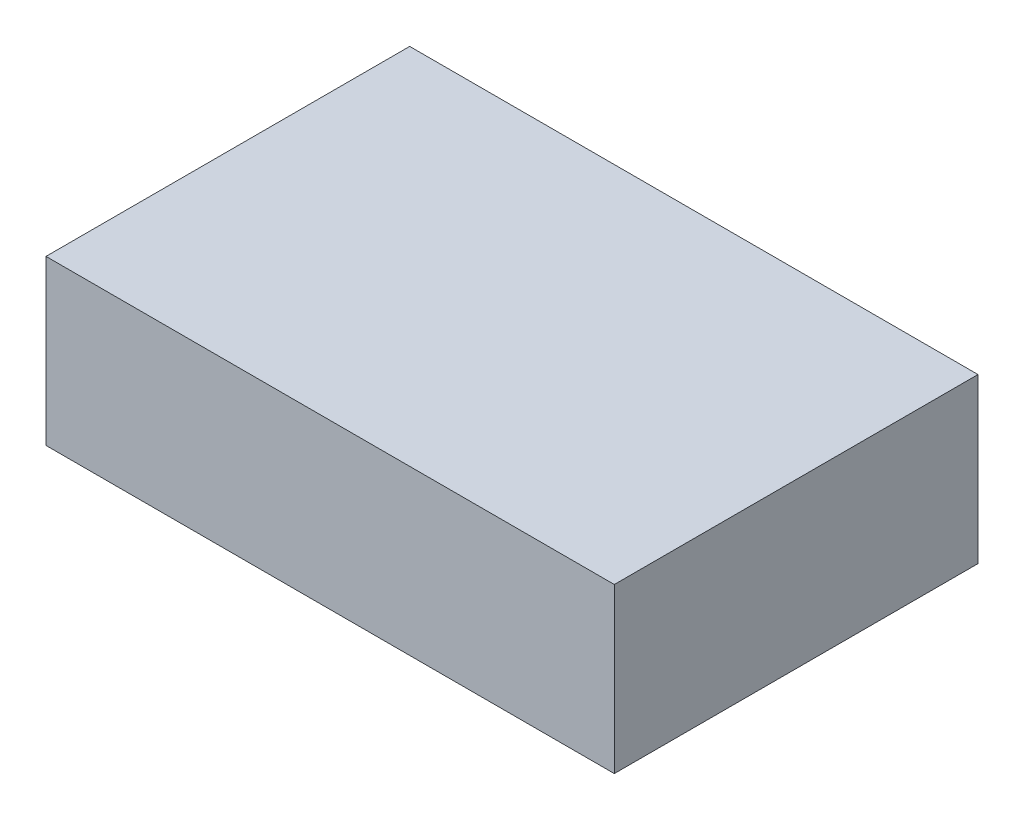
from build123d import *

# Parameters (mm, degrees)
SKETCH1_W           = 117.983
SKETCH1_H           = 75.5
BOSS_EXTRUDE1_DEPTH = 34


with BuildPart() as part:
    # Sketch1 → Boss-Extrude1 (new body)
    with BuildSketch(Plane(origin=(0, 0, 0), x_dir=(1, 0, 0), z_dir=(0, 1, 0))):
        with Locations((58.9915, 37.75)):
            Rectangle(SKETCH1_W, SKETCH1_H)
    extrude(amount=BOSS_EXTRUDE1_DEPTH)


solid = part.part
